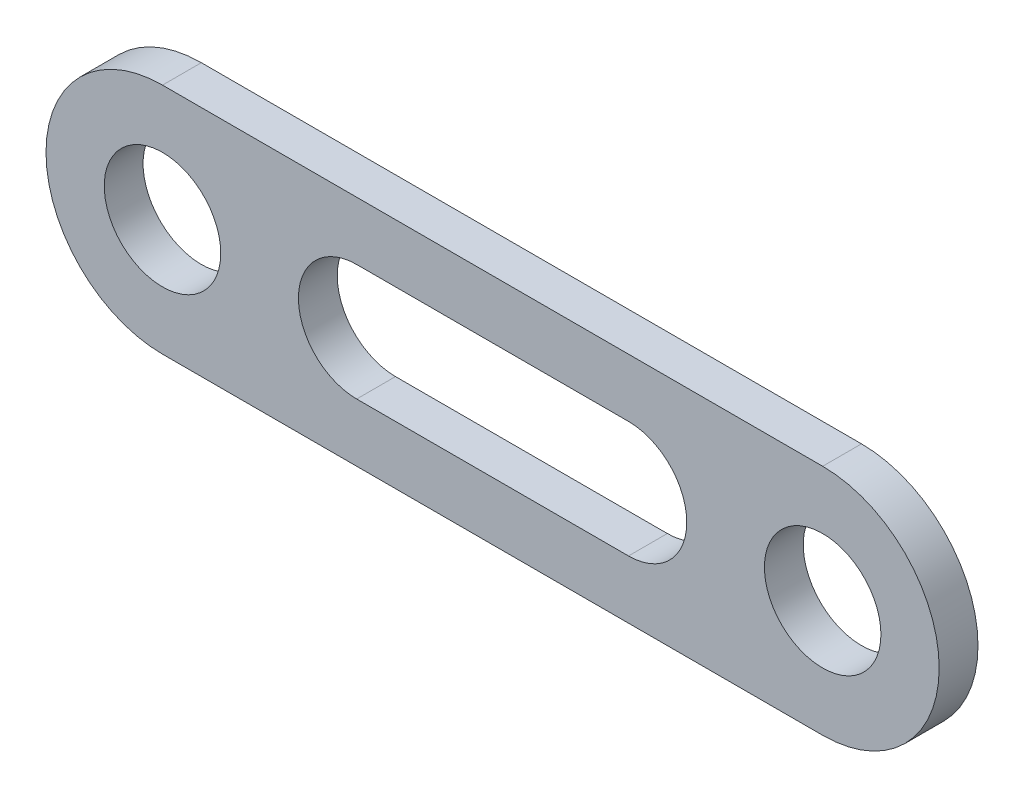
from build123d import *

# Parameters (mm, degrees)
SKETCH_2_R      = 3
EXTRUDE_1_DEPTH = 2


with BuildPart() as part:
    # 草图2 → 凸台-拉伸1 (new body)
    with BuildSketch(Plane.XY):
        with BuildLine():
            Line((0, 6), (34, 6))
            ThreePointArc((34, 6), (40, 0), (34, -6))
            Line((34, -6), (0, -6))
            ThreePointArc((0, -6), (-6, 0), (0, 6))
        make_face()
        Circle(SKETCH_2_R, mode=Mode.SUBTRACT)
        with Locations((34, 0)):
            Circle(SKETCH_2_R, mode=Mode.SUBTRACT)
        with BuildLine():
            Line((10, 3), (24, 3))
            ThreePointArc((24, 3), (27, 0), (24, -3))
            Line((24, -3), (10, -3))
            ThreePointArc((10, -3), (7, 0), (10, 3))
        make_face(mode=Mode.SUBTRACT)
    extrude(amount=EXTRUDE_1_DEPTH)


solid = part.part
